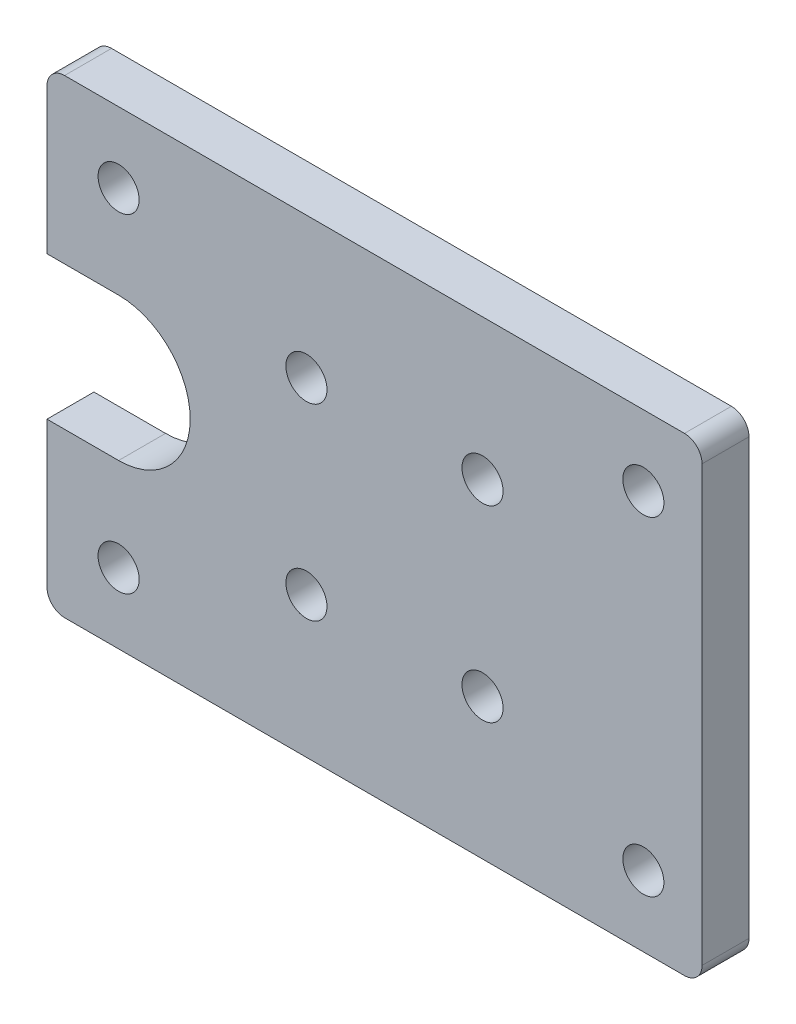
from build123d import *

# Parameters (mm, degrees)
EXTRUDE_2_DEPTH     = 4
SKETCH_4_R          = 6.1
SKETCH_4_R_2        = 1.75
CUT_EXTRUDE_1_DEPTH = 39.794329483
SKETCH_5_W          = 5
SKETCH_5_H          = 40
CUT_EXTRUDE_2_DEPTH = 4
FILLET_1_R          = 1.5


with BuildPart() as part:
    # Эскиз1 → Бобышка-Вытянуть2 (new body)
    with BuildSketch(Plane.XY):
        with BuildLine():
            Line((31.5, -20), (-31.5, -20))
            ThreePointArc((-31.5, -20), (-32.560660172, -19.560660172), (-33, -18.5))
            Line((-33, -18.5), (-33, 18.5))
            ThreePointArc((-33, 18.5), (-32.560660172, 19.560660172), (-31.5, 20))
            Line((-31.5, 20), (31.5, 20))
            ThreePointArc((31.5, 20), (32.560660172, 19.560660172), (33, 18.5))
            Line((33, 18.5), (33, -18.5))
            ThreePointArc((33, -18.5), (32.560660172, -19.560660172), (31.5, -20))
        make_face()
    extrude(amount=EXTRUDE_2_DEPTH)

    # Эскиз4 → Вырез-Вытянуть1 (cut, through all)
    with BuildSketch(Plane(origin=(0, 0, 0), x_dir=(-1, 0, 0), z_dir=(0, 0, -1))):
        with Locations((21.7, 0)):
            Circle(SKETCH_4_R)
        with Locations((21.7, -14)):
            Circle(SKETCH_4_R_2)
        with Locations((5.7, -8)):
            Circle(SKETCH_4_R_2)
        with Locations((-9.3, -8)):
            Circle(SKETCH_4_R_2)
        with Locations((-23, -14)):
            Circle(SKETCH_4_R_2)
        with Locations(Location((21.7, 14, 0), (0, 0, 180))):
            Circle(SKETCH_4_R_2)
        with Locations(Location((5.7, 8, 0), (0, 0, 180))):
            Circle(SKETCH_4_R_2)
        with Locations(Location((-9.3, 8, 0), (0, 0, 180))):
            Circle(SKETCH_4_R_2)
        with Locations(Location((-23, 14, 0), (0, 0, 180))):
            Circle(SKETCH_4_R_2)
    extrude(amount=-CUT_EXTRUDE_1_DEPTH, mode=Mode.SUBTRACT)

    # Эскиз5 → Вырез-Вытянуть2 (cut)
    with BuildSketch(Plane(origin=(0, 0, 0), x_dir=(-1, 0, 0), z_dir=(0, 0, -1))):
        Polygon((27.8, 20), (33, 20), (33, -20), (27.8, -20), (27.8, -6.1), (21.7, -6.1), (21.7, 6.1), (27.8, 6.1), align=None)
        with Locations((-30.5, 0)):
            Rectangle(SKETCH_5_W, SKETCH_5_H)
    extrude(amount=-CUT_EXTRUDE_2_DEPTH, mode=Mode.SUBTRACT)

    # Скругление1
    fillet_1_edges = [part.edges().sort_by_distance(p)[0] for p in [
        (28, 20, 2),
        (28, -20, 2),
        (-27.8, 20, 2),
        (-27.8, -20, 2),
    ]]
    fillet(fillet_1_edges, radius=FILLET_1_R)


solid = part.part
